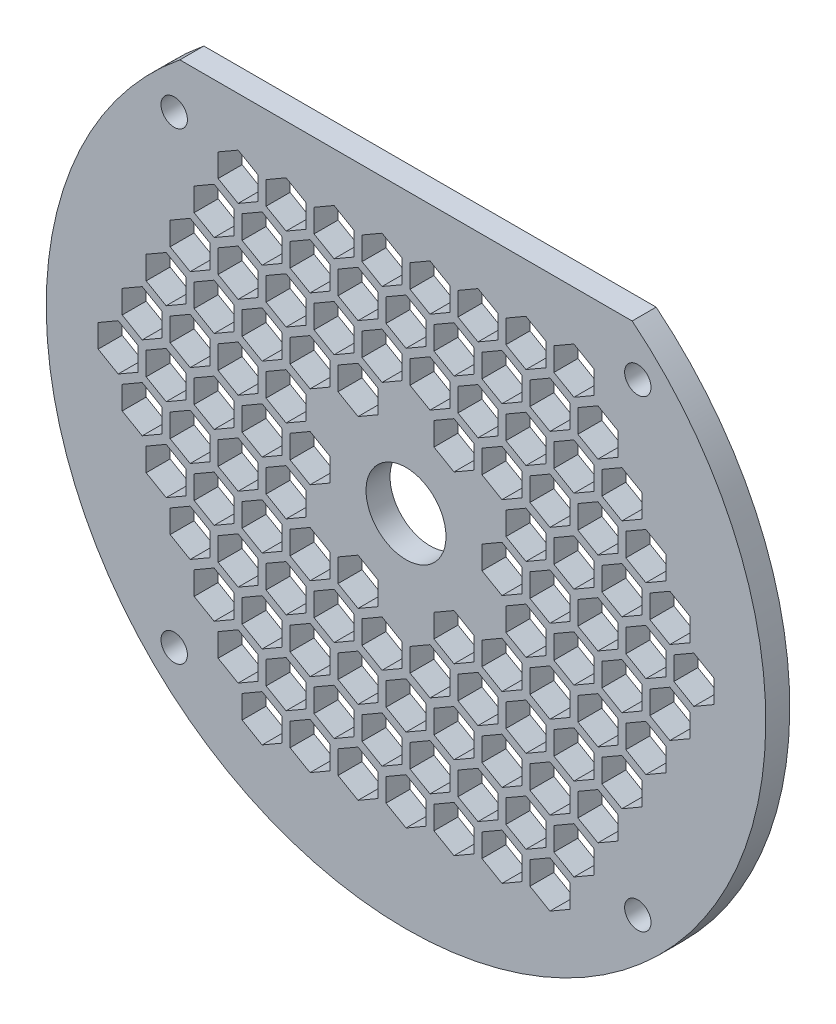
from build123d import *

# Parameters (mm, degrees)
SKETCH_1_R           = 90
EXTRUDE_1_DEPTH      = 6
SKETCH_2_W           = 400
SKETCH_2_H           = 240
CUT_EXTRUDE_1_DEPTH  = 6
CUT_EXTRUDE_2_DEPTH  = 181
CUT_EXTRUDE_3_DEPTH  = 181
EXTRUDE_2_DEPTH      = 6
CUT_EXTRUDE_6_DEPTH  = 181
CUT_EXTRUDE_7_DEPTH  = 181
CUT_EXTRUDE_8_DEPTH  = 181
CUT_EXTRUDE_9_DEPTH  = 181
SKETCH_12_R          = 10
CUT_EXTRUDE_12_DEPTH = 181
EXTRUDE_3_DEPTH      = 6
CUT_EXTRUDE_13_DEPTH = 181
SKETCH_15_R          = 3.3
CUT_EXTRUDE_14_DEPTH = 181


with BuildPart() as part:
    # 草图1 → 凸台-拉伸1 (new body)
    with BuildSketch(Plane.XY):
        Circle(SKETCH_1_R)
    extrude(amount=EXTRUDE_1_DEPTH)

    # 草图2 → 切除-拉伸1 (cut)
    with BuildSketch(Plane.XY):
        with Locations((0, 190)):
            Rectangle(SKETCH_2_W, SKETCH_2_H)
    extrude(amount=CUT_EXTRUDE_1_DEPTH, mode=Mode.SUBTRACT)

    # 草图3 → 切除-拉伸2 (cut, symmetric)
    with BuildSketch(Plane.XY):
        Polygon((24, 5.7735), (19, 2.88675), (19, -2.88675), (24, -5.7735), (29, -2.88675), (29, 2.88675), align=None)
        Polygon((-24, 5.7735), (-29, 2.88675), (-29, -2.88675), (-24, -5.7735), (-19, -2.88675), (-19, 2.88675), align=None)
        Polygon((36, 5.7735), (31, 2.88675), (31, -2.88675), (36, -5.7735), (41, -2.88675), (41, 2.88675), align=None)
        Polygon((-36, 5.7735), (-41, 2.88675), (-41, -2.88675), (-36, -5.7735), (-31, -2.88675), (-31, 2.88675), align=None)
        Polygon((48, 5.7735), (43, 2.88675), (43, -2.88675), (48, -5.7735), (53, -2.88675), (53, 2.88675), align=None)
        Polygon((-48, 5.7735), (-53, 2.88675), (-53, -2.88675), (-48, -5.7735), (-43, -2.88675), (-43, 2.88675), align=None)
        Polygon((60, 5.7735), (55, 2.88675), (55, -2.88675), (60, -5.7735), (65, -2.88675), (65, 2.88675), align=None)
        Polygon((-60, 5.7735), (-65, 2.88675), (-65, -2.88675), (-60, -5.7735), (-55, -2.88675), (-55, 2.88675), align=None)
        Polygon((72, 5.7735), (67, 2.88675), (67, -2.88675), (72, -5.7735), (77, -2.88675), (77, 2.88675), align=None)
        Polygon((-72, 5.7735), (-77, 2.88675), (-77, -2.88675), (-72, -5.7735), (-67, -2.88675), (-67, 2.88675), align=None)
        Polygon((30, 16.1655), (25, 13.27875), (25, 7.50525), (30, 4.6185), (35, 7.50525), (35, 13.27875), align=None)
        Polygon((-30, 16.1655), (-35, 13.27875), (-35, 7.50525), (-30, 4.6185), (-25, 7.50525), (-25, 13.27875), align=None)
        Polygon((42, 16.1655), (37, 13.27875), (37, 7.50525), (42, 4.6185), (47, 7.50525), (47, 13.27875), align=None)
        Polygon((-42, 16.1655), (-47, 13.27875), (-47, 7.50525), (-42, 4.6185), (-37, 7.50525), (-37, 13.27875), align=None)
        Polygon((54, 16.1655), (49, 13.27875), (49, 7.50525), (54, 4.6185), (59, 7.50525), (59, 13.27875), align=None)
        Polygon((-54, 16.1655), (-59, 13.27875), (-59, 7.50525), (-54, 4.6185), (-49, 7.50525), (-49, 13.27875), align=None)
        Polygon((66, 16.1655), (61, 13.27875), (61, 7.50525), (66, 4.6185), (71, 7.50525), (71, 13.27875), align=None)
        Polygon((-66, 16.1655), (-71, 13.27875), (-71, 7.50525), (-66, 4.6185), (-61, 7.50525), (-61, 13.27875), align=None)
        Polygon((30, -4.6185), (25, -7.50525), (25, -13.27875), (30, -16.1655), (35, -13.27875), (35, -7.50525), align=None)
        Polygon((-30, -4.6185), (-35, -7.50525), (-35, -13.27875), (-30, -16.1655), (-25, -13.27875), (-25, -7.50525), align=None)
        Polygon((42, -4.6185), (37, -7.50525), (37, -13.27875), (42, -16.1655), (47, -13.27875), (47, -7.50525), align=None)
        Polygon((-42, -4.6185), (-47, -7.50525), (-47, -13.27875), (-42, -16.1655), (-37, -13.27875), (-37, -7.50525), align=None)
        Polygon((54, -4.6185), (49, -7.50525), (49, -13.27875), (54, -16.1655), (59, -13.27875), (59, -7.50525), align=None)
        Polygon((-54, -4.6185), (-59, -7.50525), (-59, -13.27875), (-54, -16.1655), (-49, -13.27875), (-49, -7.50525), align=None)
        Polygon((66, -4.6185), (61, -7.50525), (61, -13.27875), (66, -16.1655), (71, -13.27875), (71, -7.50525), align=None)
        Polygon((-66, -4.6185), (-71, -7.50525), (-71, -13.27875), (-66, -16.1655), (-61, -13.27875), (-61, -7.50525), align=None)
    extrude(amount=CUT_EXTRUDE_2_DEPTH, both=True, mode=Mode.SUBTRACT)

    # 草图4 → 切除-拉伸3 (cut, symmetric)
    with BuildSketch(Plane.XY):
        Polygon((-60, 26.5575), (-65, 23.67075), (-65, 17.89725), (-60, 15.0105), (-55, 17.89725), (-55, 23.67075), align=None)
        Polygon((-48, 26.5575), (-53, 23.67075), (-53, 17.89725), (-48, 15.0105), (-43, 17.89725), (-43, 23.67075), align=None)
        Polygon((-36, 26.5575), (-41, 23.67075), (-41, 17.89725), (-36, 15.0105), (-31, 17.89725), (-31, 23.67075), align=None)
        Polygon((-24, 26.5575), (-29, 23.67075), (-29, 17.89725), (-24, 15.0105), (-19, 17.89725), (-19, 23.67075), align=None)
        Polygon((-12, 26.5575), (-17, 23.67075), (-17, 17.89725), (-12, 15.0105), (-7, 17.89725), (-7, 23.67075), align=None)
        Polygon((0, 26.5575), (-5, 23.67075), (-5, 17.89725), (0, 15.0105), (5, 17.89725), (5, 23.67075), align=None)
        Polygon((12, 26.5575), (7, 23.67075), (7, 17.89725), (12, 15.0105), (17, 17.89725), (17, 23.67075), align=None)
        Polygon((24, 26.5575), (19, 23.67075), (19, 17.89725), (24, 15.0105), (29, 17.89725), (29, 23.67075), align=None)
        Polygon((36, 26.5575), (31, 23.67075), (31, 17.89725), (36, 15.0105), (41, 17.89725), (41, 23.67075), align=None)
        Polygon((48, 26.5575), (43, 23.67075), (43, 17.89725), (48, 15.0105), (53, 17.89725), (53, 23.67075), align=None)
        Polygon((60, 26.5575), (55, 23.67075), (55, 17.89725), (60, 15.0105), (65, 17.89725), (65, 23.67075), align=None)
        Polygon((-60, -15.0105), (-65, -17.89725), (-65, -23.67075), (-60, -26.5575), (-55, -23.67075), (-55, -17.89725), align=None)
        Polygon((-48, -15.0105), (-53, -17.89725), (-53, -23.67075), (-48, -26.5575), (-43, -23.67075), (-43, -17.89725), align=None)
        Polygon((-36, -15.0105), (-41, -17.89725), (-41, -23.67075), (-36, -26.5575), (-31, -23.67075), (-31, -17.89725), align=None)
        Polygon((-24, -15.0105), (-29, -17.89725), (-29, -23.67075), (-24, -26.5575), (-19, -23.67075), (-19, -17.89725), align=None)
        Polygon((-12, -15.0105), (-17, -17.89725), (-17, -23.67075), (-12, -26.5575), (-7, -23.67075), (-7, -17.89725), align=None)
        Polygon((0, -15.0105), (-5, -17.89725), (-5, -23.67075), (0, -26.5575), (5, -23.67075), (5, -17.89725), align=None)
        Polygon((12, -15.0105), (7, -17.89725), (7, -23.67075), (12, -26.5575), (17, -23.67075), (17, -17.89725), align=None)
        Polygon((24, -15.0105), (19, -17.89725), (19, -23.67075), (24, -26.5575), (29, -23.67075), (29, -17.89725), align=None)
        Polygon((36, -15.0105), (31, -17.89725), (31, -23.67075), (36, -26.5575), (41, -23.67075), (41, -17.89725), align=None)
        Polygon((48, -15.0105), (43, -17.89725), (43, -23.67075), (48, -26.5575), (53, -23.67075), (53, -17.89725), align=None)
        Polygon((60, -15.0105), (55, -17.89725), (55, -23.67075), (60, -26.5575), (65, -23.67075), (65, -17.89725), align=None)
    extrude(amount=CUT_EXTRUDE_3_DEPTH, both=True, mode=Mode.SUBTRACT)

    # 草图5 → 凸台-拉伸2 (add)
    with BuildSketch(Plane.XY):
        Polygon((0, 26.5575), (-5, 23.67075), (-5, 17.89725), (0, 15.0105), (5, 17.89725), (5, 23.67075), align=None)
        Polygon((0, -15.0105), (-5, -17.89725), (-5, -23.67075), (0, -26.5575), (5, -23.67075), (5, -17.89725), align=None)
    extrude(amount=EXTRUDE_2_DEPTH)

    # 草图7 → 切除-拉伸6 (cut, symmetric)
    with BuildSketch(Plane.XY):
        Polygon((6, 36.9495), (1, 34.06275), (1, 28.28925), (6, 25.4025), (11, 28.28925), (11, 34.06275), align=None)
        Polygon((-6, 36.9495), (-11, 34.06275), (-11, 28.28925), (-6, 25.4025), (-1, 28.28925), (-1, 34.06275), align=None)
        Polygon((18, 36.9495), (13, 34.06275), (13, 28.28925), (18, 25.4025), (23, 28.28925), (23, 34.06275), align=None)
        Polygon((-18, 36.9495), (-23, 34.06275), (-23, 28.28925), (-18, 25.4025), (-13, 28.28925), (-13, 34.06275), align=None)
        Polygon((30, 36.9495), (25, 34.06275), (25, 28.28925), (30, 25.4025), (35, 28.28925), (35, 34.06275), align=None)
        Polygon((-30, 36.9495), (-35, 34.06275), (-35, 28.28925), (-30, 25.4025), (-25, 28.28925), (-25, 34.06275), align=None)
        Polygon((42, 36.9495), (37, 34.06275), (37, 28.28925), (42, 25.4025), (47, 28.28925), (47, 34.06275), align=None)
        Polygon((-42, 36.9495), (-47, 34.06275), (-47, 28.28925), (-42, 25.4025), (-37, 28.28925), (-37, 34.06275), align=None)
        Polygon((54, 36.9495), (49, 34.06275), (49, 28.28925), (54, 25.4025), (59, 28.28925), (59, 34.06275), align=None)
        Polygon((-54, 36.9495), (-59, 34.06275), (-59, 28.28925), (-54, 25.4025), (-49, 28.28925), (-49, 34.06275), align=None)
        Polygon((6, -25.4025), (1, -28.28925), (1, -34.06275), (6, -36.9495), (11, -34.06275), (11, -28.28925), align=None)
        Polygon((-6, -25.4025), (-11, -28.28925), (-11, -34.06275), (-6, -36.9495), (-1, -34.06275), (-1, -28.28925), align=None)
        Polygon((18, -25.4025), (13, -28.28925), (13, -34.06275), (18, -36.9495), (23, -34.06275), (23, -28.28925), align=None)
        Polygon((-18, -25.4025), (-23, -28.28925), (-23, -34.06275), (-18, -36.9495), (-13, -34.06275), (-13, -28.28925), align=None)
        Polygon((30, -25.4025), (25, -28.28925), (25, -34.06275), (30, -36.9495), (35, -34.06275), (35, -28.28925), align=None)
        Polygon((-30, -25.4025), (-35, -28.28925), (-35, -34.06275), (-30, -36.9495), (-25, -34.06275), (-25, -28.28925), align=None)
        Polygon((42, -25.4025), (37, -28.28925), (37, -34.06275), (42, -36.9495), (47, -34.06275), (47, -28.28925), align=None)
        Polygon((-42, -25.4025), (-47, -28.28925), (-47, -34.06275), (-42, -36.9495), (-37, -34.06275), (-37, -28.28925), align=None)
        Polygon((54, -25.4025), (49, -28.28925), (49, -34.06275), (54, -36.9495), (59, -34.06275), (59, -28.28925), align=None)
        Polygon((-54, -25.4025), (-59, -28.28925), (-59, -34.06275), (-54, -36.9495), (-49, -34.06275), (-49, -28.28925), align=None)
    extrude(amount=CUT_EXTRUDE_6_DEPTH, both=True, mode=Mode.SUBTRACT)

    # 草图8 → 切除-拉伸7 (cut, symmetric)
    with BuildSketch(Plane.XY):
        Polygon((0, 47.3415), (-5, 44.45475), (-5, 38.68125), (0, 35.7945), (5, 38.68125), (5, 44.45475), align=None)
        Polygon((12, 47.3415), (7, 44.45475), (7, 38.68125), (12, 35.7945), (17, 38.68125), (17, 44.45475), align=None)
        Polygon((-12, 47.3415), (-17, 44.45475), (-17, 38.68125), (-12, 35.7945), (-7, 38.68125), (-7, 44.45475), align=None)
        Polygon((24, 47.3415), (19, 44.45475), (19, 38.68125), (24, 35.7945), (29, 38.68125), (29, 44.45475), align=None)
        Polygon((-24, 47.3415), (-29, 44.45475), (-29, 38.68125), (-24, 35.7945), (-19, 38.68125), (-19, 44.45475), align=None)
        Polygon((36, 47.3415), (31, 44.45475), (31, 38.68125), (36, 35.7945), (41, 38.68125), (41, 44.45475), align=None)
        Polygon((-36, 47.3415), (-41, 44.45475), (-41, 38.68125), (-36, 35.7945), (-31, 38.68125), (-31, 44.45475), align=None)
        Polygon((48, 47.3415), (43, 44.45475), (43, 38.68125), (48, 35.7945), (53, 38.68125), (53, 44.45475), align=None)
        Polygon((-48, 47.3415), (-53, 44.45475), (-53, 38.68125), (-48, 35.7945), (-43, 38.68125), (-43, 44.45475), align=None)
        Polygon((0, -35.7945), (-5, -38.68125), (-5, -44.45475), (0, -47.3415), (5, -44.45475), (5, -38.68125), align=None)
        Polygon((12, -35.7945), (7, -38.68125), (7, -44.45475), (12, -47.3415), (17, -44.45475), (17, -38.68125), align=None)
        Polygon((-12, -35.7945), (-17, -38.68125), (-17, -44.45475), (-12, -47.3415), (-7, -44.45475), (-7, -38.68125), align=None)
        Polygon((24, -35.7945), (19, -38.68125), (19, -44.45475), (24, -47.3415), (29, -44.45475), (29, -38.68125), align=None)
        Polygon((-24, -35.7945), (-29, -38.68125), (-29, -44.45475), (-24, -47.3415), (-19, -44.45475), (-19, -38.68125), align=None)
        Polygon((36, -35.7945), (31, -38.68125), (31, -44.45475), (36, -47.3415), (41, -44.45475), (41, -38.68125), align=None)
        Polygon((-36, -35.7945), (-41, -38.68125), (-41, -44.45475), (-36, -47.3415), (-31, -44.45475), (-31, -38.68125), align=None)
        Polygon((48, -35.7945), (43, -38.68125), (43, -44.45475), (48, -47.3415), (53, -44.45475), (53, -38.68125), align=None)
        Polygon((-48, -35.7945), (-53, -38.68125), (-53, -44.45475), (-48, -47.3415), (-43, -44.45475), (-43, -38.68125), align=None)
    extrude(amount=CUT_EXTRUDE_7_DEPTH, both=True, mode=Mode.SUBTRACT)

    # 草图9 → 切除-拉伸8 (cut, symmetric)
    with BuildSketch(Plane.XY):
        Polygon((5, 44.45475), (0, 47.3415), (-5, 44.45475), (-5, 38.68125), (0, 35.7945), (5, 38.68125), align=None)
        Polygon((17, 44.45475), (12, 47.3415), (7, 44.45475), (7, 38.68125), (12, 35.7945), (17, 38.68125), align=None)
        Polygon((-7, 44.45475), (-12, 47.3415), (-17, 44.45475), (-17, 38.68125), (-12, 35.7945), (-7, 38.68125), align=None)
        Polygon((29, 44.45475), (24, 47.3415), (19, 44.45475), (19, 38.68125), (24, 35.7945), (29, 38.68125), align=None)
        Polygon((-19, 44.45475), (-24, 47.3415), (-29, 44.45475), (-29, 38.68125), (-24, 35.7945), (-19, 38.68125), align=None)
        Polygon((41, 44.45475), (36, 47.3415), (31, 44.45475), (31, 38.68125), (36, 35.7945), (41, 38.68125), align=None)
        Polygon((-31, 44.45475), (-36, 47.3415), (-41, 44.45475), (-41, 38.68125), (-36, 35.7945), (-31, 38.68125), align=None)
        Polygon((53, 44.45475), (48, 47.3415), (43, 44.45475), (43, 38.68125), (48, 35.7945), (53, 38.68125), align=None)
        Polygon((-43, 44.45475), (-48, 47.3415), (-53, 44.45475), (-53, 38.68125), (-48, 35.7945), (-43, 38.68125), align=None)
        Polygon((5, -38.68125), (0, -35.7945), (-5, -38.68125), (-5, -44.45475), (0, -47.3415), (5, -44.45475), align=None)
        Polygon((17, -38.68125), (12, -35.7945), (7, -38.68125), (7, -44.45475), (12, -47.3415), (17, -44.45475), align=None)
        Polygon((-7, -38.68125), (-12, -35.7945), (-17, -38.68125), (-17, -44.45475), (-12, -47.3415), (-7, -44.45475), align=None)
        Polygon((29, -38.68125), (24, -35.7945), (19, -38.68125), (19, -44.45475), (24, -47.3415), (29, -44.45475), align=None)
        Polygon((-19, -38.68125), (-24, -35.7945), (-29, -38.68125), (-29, -44.45475), (-24, -47.3415), (-19, -44.45475), align=None)
        Polygon((41, -38.68125), (36, -35.7945), (31, -38.68125), (31, -44.45475), (36, -47.3415), (41, -44.45475), align=None)
        Polygon((-31, -38.68125), (-36, -35.7945), (-41, -38.68125), (-41, -44.45475), (-36, -47.3415), (-31, -44.45475), align=None)
        Polygon((53, -38.68125), (48, -35.7945), (43, -38.68125), (43, -44.45475), (48, -47.3415), (53, -44.45475), align=None)
        Polygon((-43, -38.68125), (-48, -35.7945), (-53, -38.68125), (-53, -44.45475), (-48, -47.3415), (-43, -44.45475), align=None)
        Polygon((11, 54.84675), (6, 57.7335), (1, 54.84675), (1, 49.07325), (6, 46.1865), (11, 49.07325), align=None)
        Polygon((-1, 54.84675), (-6, 57.7335), (-11, 54.84675), (-11, 49.07325), (-6, 46.1865), (-1, 49.07325), align=None)
        Polygon((23, 54.84675), (18, 57.7335), (13, 54.84675), (13, 49.07325), (18, 46.1865), (23, 49.07325), align=None)
        Polygon((-13, 54.84675), (-18, 57.7335), (-23, 54.84675), (-23, 49.07325), (-18, 46.1865), (-13, 49.07325), align=None)
        Polygon((35, 54.84675), (30, 57.7335), (25, 54.84675), (25, 49.07325), (30, 46.1865), (35, 49.07325), align=None)
        Polygon((-25, 54.84675), (-30, 57.7335), (-35, 54.84675), (-35, 49.07325), (-30, 46.1865), (-25, 49.07325), align=None)
        Polygon((47, 54.84675), (42, 57.7335), (37, 54.84675), (37, 49.07325), (42, 46.1865), (47, 49.07325), align=None)
        Polygon((-37, 54.84675), (-42, 57.7335), (-47, 54.84675), (-47, 49.07325), (-42, 46.1865), (-37, 49.07325), align=None)
        Polygon((11, -49.07325), (6, -46.1865), (1, -49.07325), (1, -54.84675), (6, -57.7335), (11, -54.84675), align=None)
        Polygon((-1, -49.07325), (-6, -46.1865), (-11, -49.07325), (-11, -54.84675), (-6, -57.7335), (-1, -54.84675), align=None)
        Polygon((23, -49.07325), (18, -46.1865), (13, -49.07325), (13, -54.84675), (18, -57.7335), (23, -54.84675), align=None)
        Polygon((-13, -49.07325), (-18, -46.1865), (-23, -49.07325), (-23, -54.84675), (-18, -57.7335), (-13, -54.84675), align=None)
        Polygon((35, -49.07325), (30, -46.1865), (25, -49.07325), (25, -54.84675), (30, -57.7335), (35, -54.84675), align=None)
        Polygon((-25, -49.07325), (-30, -46.1865), (-35, -49.07325), (-35, -54.84675), (-30, -57.7335), (-25, -54.84675), align=None)
        Polygon((47, -49.07325), (42, -46.1865), (37, -49.07325), (37, -54.84675), (42, -57.7335), (47, -54.84675), align=None)
        Polygon((-37, -49.07325), (-42, -46.1865), (-47, -49.07325), (-47, -54.84675), (-42, -57.7335), (-37, -54.84675), align=None)
    extrude(amount=CUT_EXTRUDE_8_DEPTH, both=True, mode=Mode.SUBTRACT)

    # 草图10 → 切除-拉伸9 (cut, symmetric)
    with BuildSketch(Plane.XY):
        Polygon((0, -56.5785), (-5, -59.46525), (-5, -65.23875), (0, -68.1255), (5, -65.23875), (5, -59.46525), align=None)
        Polygon((12, -56.5785), (7, -59.46525), (7, -65.23875), (12, -68.1255), (17, -65.23875), (17, -59.46525), align=None)
        Polygon((-12, -56.5785), (-17, -59.46525), (-17, -65.23875), (-12, -68.1255), (-7, -65.23875), (-7, -59.46525), align=None)
        Polygon((24, -56.5785), (19, -59.46525), (19, -65.23875), (24, -68.1255), (29, -65.23875), (29, -59.46525), align=None)
        Polygon((-24, -56.5785), (-29, -59.46525), (-29, -65.23875), (-24, -68.1255), (-19, -65.23875), (-19, -59.46525), align=None)
        Polygon((36, -56.5785), (31, -59.46525), (31, -65.23875), (36, -68.1255), (41, -65.23875), (41, -59.46525), align=None)
        Polygon((-36, -56.5785), (-41, -59.46525), (-41, -65.23875), (-36, -68.1255), (-31, -65.23875), (-31, -59.46525), align=None)
    extrude(amount=CUT_EXTRUDE_9_DEPTH, both=True, mode=Mode.SUBTRACT)

    # 草图12 → 切除-拉伸12 (cut, symmetric)
    with BuildSketch(Plane.XY):
        Circle(SKETCH_12_R)
    extrude(amount=CUT_EXTRUDE_12_DEPTH, both=True, mode=Mode.SUBTRACT)

    # 草图13 → 凸台-拉伸3 (add)
    with BuildSketch(Plane.XY):
        Polygon((24, 5.7735), (19, 2.88675), (19, -2.88675), (24, -5.7735), (29, -2.88675), (29, 2.88675), align=None)
        Polygon((-24, 5.7735), (-29, 2.88675), (-29, -2.88675), (-24, -5.7735), (-19, -2.88675), (-19, 2.88675), align=None)
        Polygon((72, 5.7735), (67, 2.88675), (67, -2.88675), (72, -5.7735), (77, -2.88675), (77, 2.88675), align=None)
        Polygon((-72, 5.7735), (-77, 2.88675), (-77, -2.88675), (-72, -5.7735), (-67, -2.88675), (-67, 2.88675), align=None)
        Polygon((36, -56.5785), (31, -59.46525), (31, -65.23875), (36, -68.1255), (41, -65.23875), (41, -59.46525), align=None)
        Polygon((-36, -56.5785), (-41, -59.46525), (-41, -65.23875), (-36, -68.1255), (-31, -65.23875), (-31, -59.46525), align=None)
    extrude(amount=EXTRUDE_3_DEPTH)

    # 草图14 → 切除-拉伸13 (cut, symmetric)
    with BuildSketch(Plane.XY):
        Polygon((24, 5.7735), (19, 2.88675), (19, -2.88675), (24, -5.7735), (29, -2.88675), (29, 2.88675), align=None)
        Polygon((-24, 5.7735), (-29, 2.88675), (-29, -2.88675), (-24, -5.7735), (-19, -2.88675), (-19, 2.88675), align=None)
        Polygon((72, 5.7735), (67, 2.88675), (67, -2.88675), (72, -5.7735), (77, -2.88675), (77, 2.88675), align=None)
        Polygon((-72, 5.7735), (-77, 2.88675), (-77, -2.88675), (-72, -5.7735), (-67, -2.88675), (-67, 2.88675), align=None)
        Polygon((36, -56.5785), (31, -59.46525), (31, -65.23875), (36, -68.1255), (41, -65.23875), (41, -59.46525), align=None)
        Polygon((-36, -56.5785), (-41, -59.46525), (-41, -65.23875), (-36, -68.1255), (-31, -65.23875), (-31, -59.46525), align=None)
    extrude(amount=CUT_EXTRUDE_13_DEPTH, both=True, mode=Mode.SUBTRACT)

    # 草图15 → 切除-拉伸14 (cut, symmetric)
    with BuildSketch(Plane.XY):
        with Locations((57.983, 57.983)):
            Circle(SKETCH_15_R)
        with Locations((-57.983, 57.983)):
            Circle(SKETCH_15_R)
        with Locations((-57.983, -57.983)):
            Circle(SKETCH_15_R)
        with Locations((57.983, -57.983)):
            Circle(SKETCH_15_R)
    extrude(amount=CUT_EXTRUDE_14_DEPTH, both=True, mode=Mode.SUBTRACT)


solid = part.part
